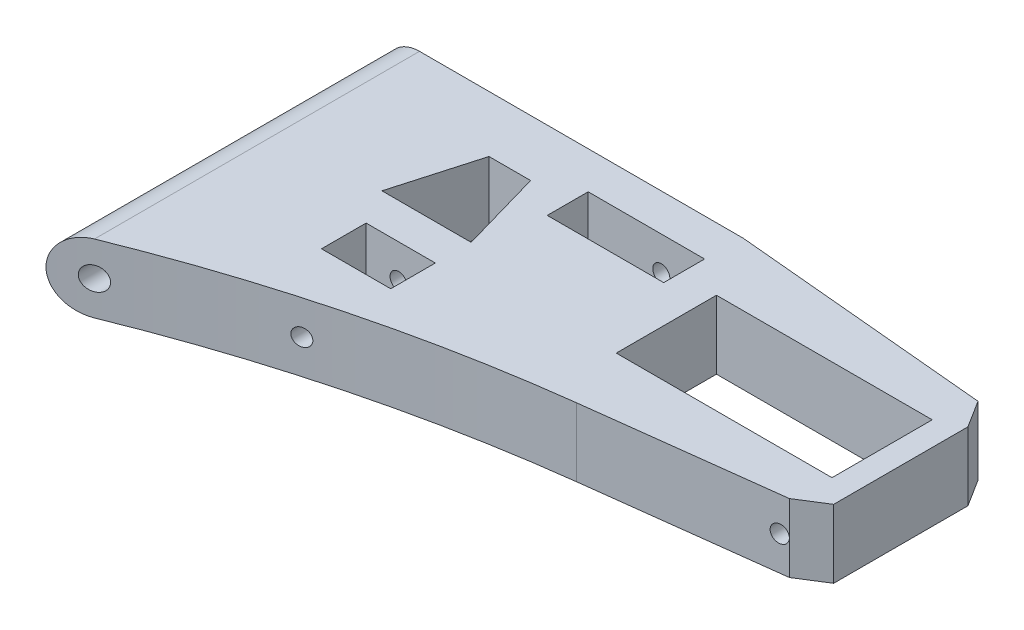
from build123d import *

# Parameters (mm, degrees)
SKETCH1_W                = 36.8554
SKETCH1_H                = 17.1196
SKETCH1_W_2              = 19.8882
SKETCH1_H_2              = 6.985
SKETCH1_W_3              = 11.8237
SKETCH1_H_3              = 7.62
BOSS_EXTRUDE1_DEPTH      = 11.684
BOSS_EXTRUDE1_2_DEPTH    = 11.684
SKETCH3_R                = 1.4605
CUT_EXTRUDE8_DEPTH       = 140.210429827
SKETCH4_R                = 1.4605
CUT_EXTRUDE9_DEPTH       = 18.034
CUT_EXTRUDE11_DEPTH      = 38.1
SKETCH6_R                = 1.4605
CUT_EXTRUDE12_DEPTH      = 16.3195
CUT_EXTRUDE13_DEPTH      = 140.210429862
CUT_EXTRUDE13_DEPTH_BACK = 140.210429862
SKETCH7_R                = 1.9685
CUT_EXTRUDE14_DEPTH      = 7.62


with BuildPart() as part:
    # Sketch1 → Boss-Extrude1 (new body)
    with BuildSketch(Plane(origin=(0, 0, 0), x_dir=(1, 0, 0), z_dir=(0, 1, 0))):
        with BuildLine():
            Line((-25.4, 37.231859639), (-67.6656, 37.231859639))
            Line((-67.6656, 37.231859639), (-86.5378, 37.231859639))
            Line((-86.5378, 37.231859639), (-130.704860186, 33.167859639))
            Line((-130.704860186, 33.167859639), (-133.6294, 28.523199453))
            Line((-133.6294, 28.523199453), (-133.6294, 5.586999453))
            Line((-133.6294, 5.586999453), (-128.984739814, 2.662459639))
            Line((-128.984739814, 2.662459639), (-96.664183529, -1.34664073))
            ThreePointArc((-96.664183529, -1.34664073), (-60.341965715, -8.501620237), (-25.4, -20.730940361))
            Line((-25.4, -20.730940361), (-25.4, 37.231859639))
        make_face()
        with Locations((-111.1123, 17.953259639)):
            Rectangle(SKETCH1_W, SKETCH1_H, mode=Mode.SUBTRACT)
        with Locations((-76.367777447, 27.363959639)):
            Rectangle(SKETCH1_W_2, SKETCH1_H_2, mode=Mode.SUBTRACT)
        with Locations((-57.99455, 3.456462042)):
            Rectangle(SKETCH1_W_3, SKETCH1_H_3, mode=Mode.SUBTRACT)
        Polygon((-63.9064, 13.384739375), (-48.6664, 13.384739375), (-52.7304, 27.608739375), (-59.8424, 27.608739375), align=None, mode=Mode.SUBTRACT)
    extrude(amount=BOSS_EXTRUDE1_DEPTH)


with BuildPart() as body_2:
    # Sketch1 → Boss-Extrude1 2 (new body)
    with BuildSketch(Plane(origin=(0, 0, 0), x_dir=(1, 0, 0), z_dir=(0, 1, 0))):
        with BuildLine():
            Line((25.4, -20.730940361), (25.4, 37.231859639))
            Line((25.4, 37.231859639), (67.6656, 37.231859639))
            Line((67.6656, 37.231859639), (86.5378, 37.231859639))
            Line((86.5378, 37.231859639), (130.704860186, 33.167859639))
            Line((130.704860186, 33.167859639), (133.6294, 28.523199453))
            Line((133.6294, 28.523199453), (133.6294, 5.586999453))
            Line((133.6294, 5.586999453), (128.984739814, 2.662459639))
            Line((128.984739814, 2.662459639), (96.664183529, -1.34664073))
            ThreePointArc((96.664183529, -1.34664073), (60.341965715, -8.501620237), (25.4, -20.730940361))
        make_face()
        Polygon((59.8424, 27.608739375), (63.9064, 13.384739375), (48.6664, 13.384739375), (52.7304, 27.608739375), align=None, mode=Mode.SUBTRACT)
        with Locations((57.99455, 3.456462042)):
            Rectangle(SKETCH1_W_3, SKETCH1_H_3, mode=Mode.SUBTRACT)
        with Locations((76.367777447, 27.363959639)):
            Rectangle(SKETCH1_W_2, SKETCH1_H_2, mode=Mode.SUBTRACT)
        with Locations((111.1123, 17.953259639)):
            Rectangle(SKETCH1_W, SKETCH1_H, mode=Mode.SUBTRACT)
    extrude(amount=BOSS_EXTRUDE1_2_DEPTH)


with BuildPart() as cut_extrude8_tool:
    # Sketch3 → Cut-Extrude8 (new, through all)
    with BuildSketch(Plane.XY):
        with Locations((-127.524239814, 5.842)):
            Circle(SKETCH3_R)
        with Locations((127.524239814, 5.842)):
            Circle(SKETCH3_R)
    extrude(amount=-CUT_EXTRUDE8_DEPTH)


with BuildPart() as part_1:
    add(part.part)

    # Cut-Extrude8: cut by cut_extrude8_tool
    add(cut_extrude8_tool.part, mode=Mode.SUBTRACT)


with BuildPart() as body_2_1:
    add(body_2.part)

    # Cut-Extrude8: cut by cut_extrude8_tool
    add(cut_extrude8_tool.part, mode=Mode.SUBTRACT)


with BuildPart() as cut_extrude9_tool:
    # Sketch4 → Cut-Extrude9 (new body)
    with BuildSketch(Plane(origin=(0, 0, -37.231859639), x_dir=(-1, 0, 0), z_dir=(0, 0, -1))):
        with Locations((78.9178, 5.842)):
            Circle(SKETCH4_R)
        with Locations((-78.9178, 5.842)):
            Circle(SKETCH4_R)
    extrude(amount=-CUT_EXTRUDE9_DEPTH)


with BuildPart() as part_2:
    add(part_1.part)

    # Cut-Extrude9: cut by cut_extrude9_tool
    add(cut_extrude9_tool.part, mode=Mode.SUBTRACT)


with BuildPart() as body_2_2:
    add(body_2_1.part)

    # Cut-Extrude9: cut by cut_extrude9_tool
    add(cut_extrude9_tool.part, mode=Mode.SUBTRACT)

    # Sketch2 → Cut-Extrude11 (cut, symmetric)
    with BuildSketch(Plane.XY):
        with BuildLine():
            Line((25.4, 5.842), (25.4, 0))
            Line((25.4, 0), (31.242, 0))
            ThreePointArc((31.242, 0), (27.111082184, 1.711082184), (25.4, 5.842))
        make_face()
        with BuildLine():
            Line((25.4, 11.684), (25.4, 5.842))
            ThreePointArc((25.4, 5.842), (27.111082184, 9.972917816), (31.242, 11.684))
            Line((31.242, 11.684), (25.4, 11.684))
        make_face()
    extrude(amount=CUT_EXTRUDE11_DEPTH, both=True, mode=Mode.SUBTRACT)

    # Sketch6 → Cut-Extrude12 (cut, symmetric)
    with BuildSketch(Plane.XY):
        with Locations((57.6326, 5.842)):
            Circle(SKETCH6_R)
    extrude(amount=CUT_EXTRUDE12_DEPTH, both=True, mode=Mode.SUBTRACT)

    # Sketch7 → Cut-Extrude13 (cut, two sides: drawn at the far end of the back side and taken through both)
    with BuildSketch(Plane.XY.offset(-CUT_EXTRUDE13_DEPTH_BACK)):
        with Locations((31.242, 5.842)):
            Circle(SKETCH7_R)
    extrude(amount=CUT_EXTRUDE13_DEPTH + CUT_EXTRUDE13_DEPTH_BACK, mode=Mode.SUBTRACT)

    # Sketch8 → Cut-Extrude14 (cut)
    with BuildSketch(Plane.XZ):
        with BuildLine():
            Line((34.870867511, 3.534001348), (24.218880791, 9.085239089))
            Line((24.218880791, 9.085239089), (24.658356534, -12.669081964))
            Line((24.658356534, -12.669081964), (33.631457802, -9.925148709))
            ThreePointArc((33.631457802, -9.925148709), (38.767733035, -3.611490076), (34.870867511, 3.534001348))
        make_face()
    extrude(amount=-CUT_EXTRUDE14_DEPTH, mode=Mode.SUBTRACT)


solid = body_2_2.part
